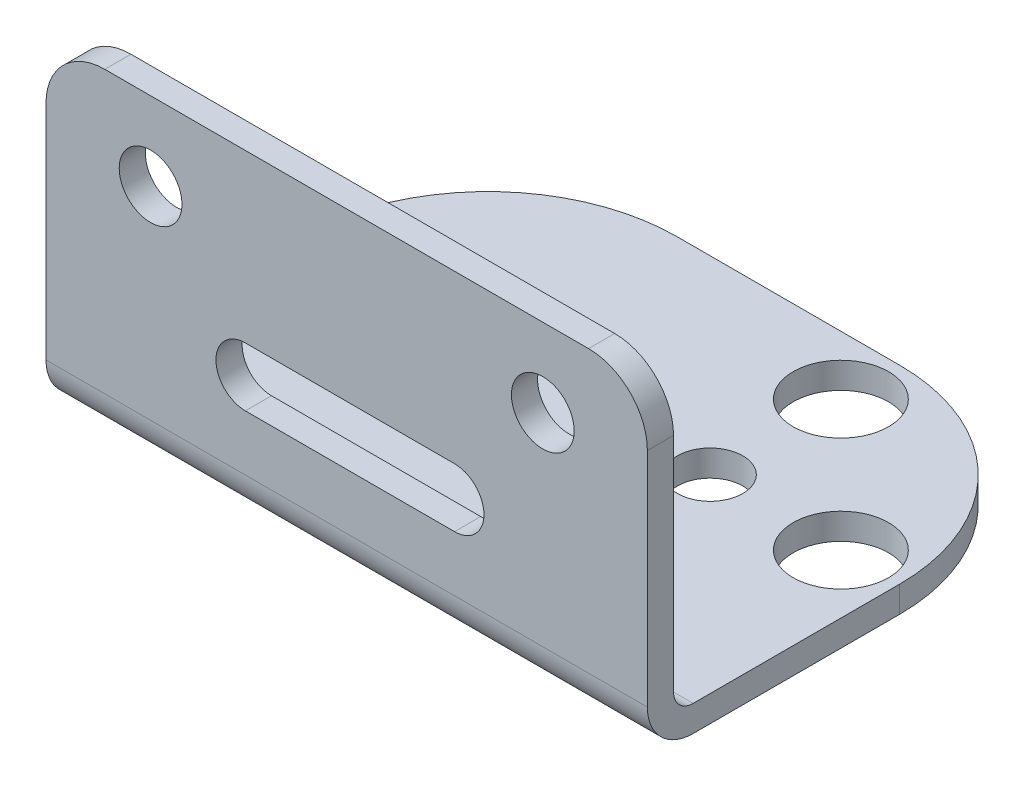
from build123d import *

# Parameters (mm, degrees)
SKETCH_3_W          = 46
SKETCH_3_H          = 33.8
EXTRUDE_1_DEPTH     = 2
FILLET_1_R          = 14.5
SKETCH_4_R          = 2.5
SKETCH_4_R_2        = 3.65
CUT_EXTRUDE_1_DEPTH = 2
SKETCH_5_W          = 46
SKETCH_5_H          = 2
EXTRUDE_2_DEPTH     = 25
FILLET_2_R          = 4.5
FILLET_3_R          = 3.5
FILLET_4_R          = 1.5
SKETCH_6_R          = 2.4
CUT_EXTRUDE_2_DEPTH = 25


with BuildPart() as part:
    # 草图3 → 凸台-拉伸1 (new body)
    with BuildSketch(Plane(origin=(0, 0, 0), x_dir=(1, 0, 0), z_dir=(0, 1, 0))):
        with Locations((23, 16.9)):
            Rectangle(SKETCH_3_W, SKETCH_3_H)
    extrude(amount=EXTRUDE_1_DEPTH)

    # 圆角1
    fillet_1_edges = [part.edges().sort_by_distance(p)[0] for p in [
        (0, 1, -33.8),
        (46, 1, -33.8),
    ]]
    fillet(fillet_1_edges, radius=FILLET_1_R)

    # 草图4 → 切除-拉伸1 (cut)
    with BuildSketch(Plane(origin=(0, 2, 0), x_dir=(1, 0, 0), z_dir=(0, 1, 0))):
        with Locations(Location((31.5, 19.3, 0), (0, 0, 270))):
            Circle(SKETCH_4_R)
        with Locations(Location((41.5, 19.3, 0), (0, 0, 270))):
            Circle(SKETCH_4_R_2)
        with Locations(Location((31.5, 29.3, 0), (0, 0, 270))):
            Circle(SKETCH_4_R_2)
        with Locations(Location((31.5, 9.3, 0), (0, 0, 270))):
            Circle(SKETCH_4_R_2)
        with Locations(Location((11.5, 19.3, 0), (0, 0, 270))):
            Circle(SKETCH_4_R_2)
    extrude(amount=-CUT_EXTRUDE_1_DEPTH, mode=Mode.SUBTRACT)

    # 草图5 → 凸台-拉伸2 (add)
    with BuildSketch(Plane.XZ):
        with Locations((23, -1)):
            Rectangle(SKETCH_5_W, SKETCH_5_H)
    extrude(amount=-EXTRUDE_2_DEPTH)

    # 圆角2
    fillet_2_edges = [part.edges().sort_by_distance(p)[0] for p in [
        (0, 25, -1),
        (46, 25, -1),
    ]]
    fillet(fillet_2_edges, radius=FILLET_2_R)

    # 圆角3
    fillet_3_edges = [part.edges().sort_by_distance(p)[0] for p in [
        (23, 0, 0),
    ]]
    fillet(fillet_3_edges, radius=FILLET_3_R)

    # 圆角4
    fillet_4_edges = [part.edges().sort_by_distance(p)[0] for p in [
        (23, 2, -2),
    ]]
    fillet(fillet_4_edges, radius=FILLET_4_R)

    # 草图6 → 切除-拉伸2 (cut)
    with BuildSketch(Plane.XY):
        with Locations(Location((38, 19, 0), (0, 0, 180))):
            Circle(SKETCH_6_R)
        with Locations(Location((8, 19, 0), (0, 0, 180))):
            Circle(SKETCH_6_R)
        with BuildLine():
            Line((15.25, 7.75), (31.25, 7.75))
            ThreePointArc((31.25, 7.75), (33.5, 10), (31.25, 12.25))
            Line((31.25, 12.25), (15.25, 12.25))
            ThreePointArc((15.25, 12.25), (13, 10), (15.25, 7.75))
        make_face()
    extrude(amount=-CUT_EXTRUDE_2_DEPTH, mode=Mode.SUBTRACT)


solid = part.part
